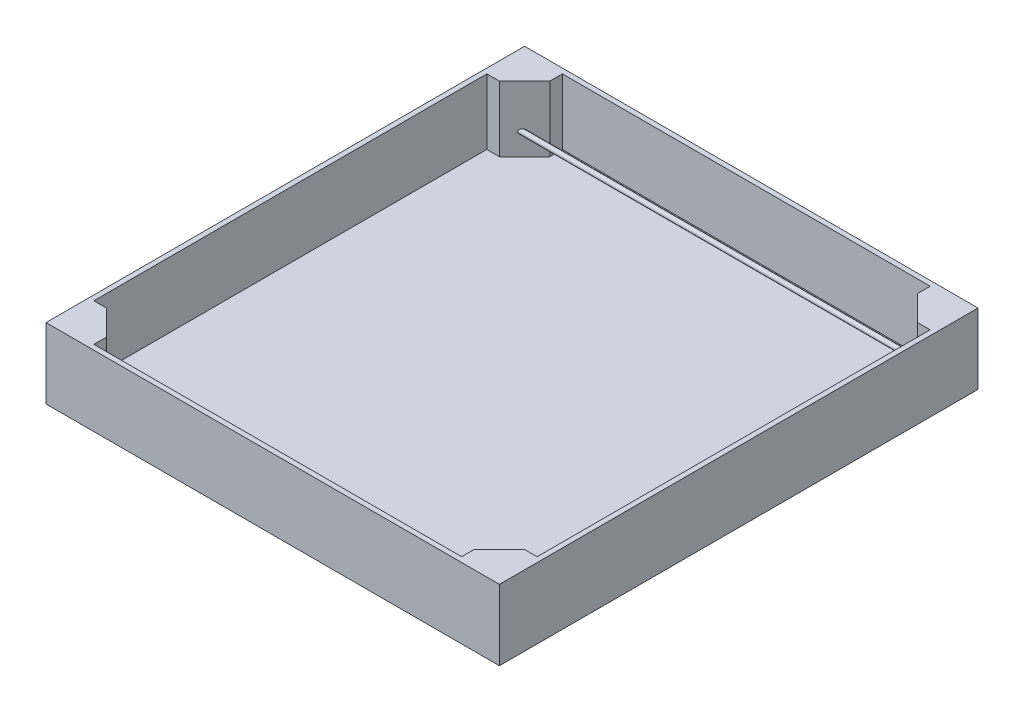
from build123d import *

# Parameters (mm, degrees)
SKETCH3_W            = 457.2
SKETCH3_H            = 482.6
BOSS_EXTRUDE2_DEPTH  = 5.08
SKETCH4_W            = 457.2
SKETCH4_H            = 482.6
SKETCH4_W_2          = 447.04
SKETCH4_H_2          = 472.44
BOSS_EXTRUDE3_DEPTH  = 66.04
BOSS_EXTRUDE4_DEPTH  = 66.04
BOSS_EXTRUDE5_DEPTH  = 66.04
BOSS_EXTRUDE6_DEPTH  = 66.04
BOSS_EXTRUDE7_DEPTH  = 66.04
SKETCH13_R           = 2.5
BOSS_EXTRUDE11_DEPTH = 447.04


with BuildPart() as part:
    # Sketch3 → Boss-Extrude2 (new body)
    with BuildSketch(Plane(origin=(0, 0, 0), x_dir=(1, 0, 0), z_dir=(0, 1, 0))):
        with Locations((228.6, 241.3)):
            Rectangle(SKETCH3_W, SKETCH3_H)
    extrude(amount=BOSS_EXTRUDE2_DEPTH)

    # Sketch4 → Boss-Extrude3 (add)
    with BuildSketch(Plane(origin=(0, 5.08, 0), x_dir=(1, 0, 0), z_dir=(0, 1, 0))):
        with Locations((228.6, 241.3)):
            Rectangle(SKETCH4_W, SKETCH4_H)
        with Locations((228.6, 241.3)):
            Rectangle(SKETCH4_W_2, SKETCH4_H_2, mode=Mode.SUBTRACT)
    extrude(amount=BOSS_EXTRUDE3_DEPTH)

    # Sketch5 → Boss-Extrude4 (add)
    with BuildSketch(Plane(origin=(0, 5.08, 0), x_dir=(1, 0, 0), z_dir=(0, 1, 0))):
        Polygon((5.08, 5.08), (43.208241799, 5.08), (43.208241799, 17.78), (17.78, 43.18), (5.08, 43.18), align=None)
    extrude(amount=BOSS_EXTRUDE4_DEPTH)

    # Sketch6 → Boss-Extrude5 (add)
    with BuildSketch(Plane(origin=(0, 5.08, 0), x_dir=(1, 0, 0), z_dir=(0, 1, 0))):
        Polygon((452.12, 5.08), (414.02, 5.08), (414.02, 17.78), (439.42, 43.111754401), (452.12, 43.111754401), align=None)
    extrude(amount=BOSS_EXTRUDE5_DEPTH)

    # Sketch7 → Boss-Extrude6 (add)
    with BuildSketch(Plane(origin=(0, 5.08, 0), x_dir=(1, 0, 0), z_dir=(0, 1, 0))):
        Polygon((452.12, 477.52), (452.12, 439.42), (439.42, 439.42), (414.088783751, 464.82), (414.088783751, 477.52), align=None)
    extrude(amount=BOSS_EXTRUDE6_DEPTH)

    # Sketch8 → Boss-Extrude7 (add)
    with BuildSketch(Plane(origin=(0, 5.08, 0), x_dir=(1, 0, 0), z_dir=(0, 1, 0))):
        Polygon((5.08, 477.52), (5.08, 439.42), (17.78, 439.42), (43.18, 464.82), (43.18, 477.52), align=None)
    extrude(amount=BOSS_EXTRUDE7_DEPTH)

    # Sketch13 → Boss-Extrude11 (add)
    with BuildSketch(Plane(origin=(5.08, 0, 0), x_dir=(0, 0, -1), z_dir=(1, 0, 0))):
        with Locations(Location((33.510747134, 26.94718976, 0), (0, 0, 180))):
            Circle(SKETCH13_R)
        with Locations(Location((451.021338275, 26.94718976, 0), (0, 0, 180))):
            Circle(SKETCH13_R)
    extrude(amount=BOSS_EXTRUDE11_DEPTH)


solid = part.part
